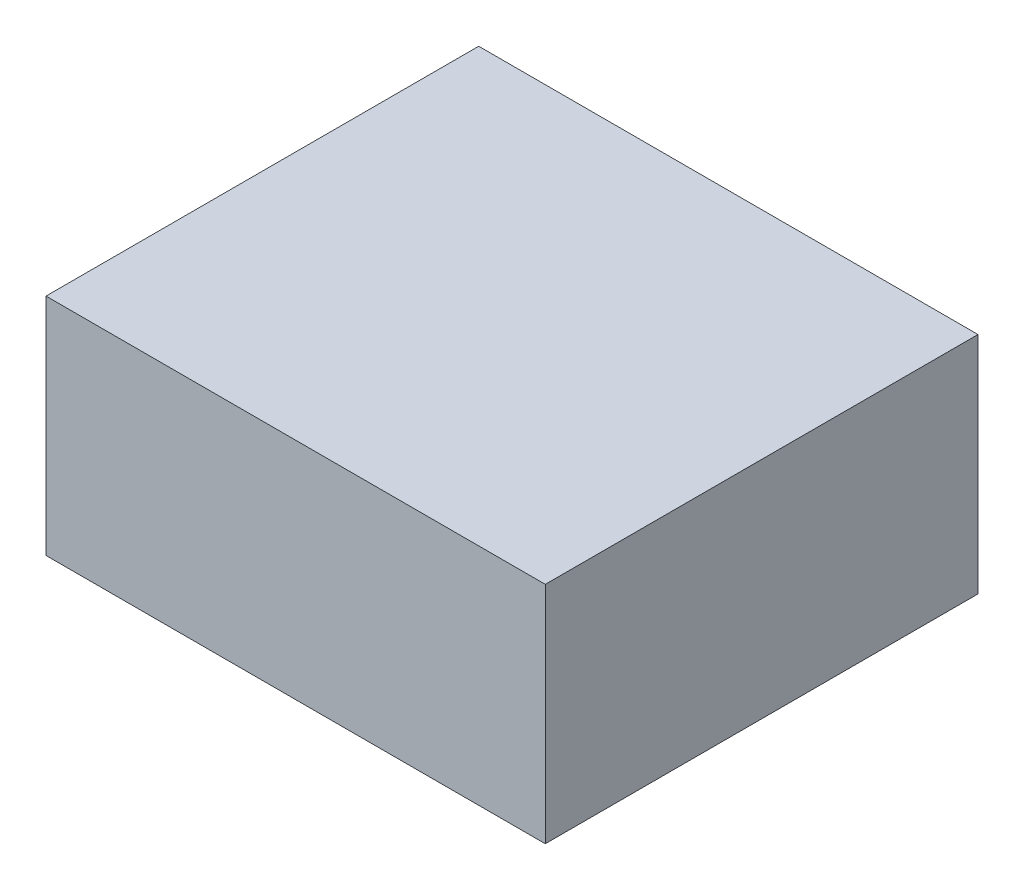
from build123d import *

# Parameters (mm, degrees)
SKETCH1_W           = 60
SKETCH1_H           = 52
BOSS_EXTRUDE1_DEPTH = 27


with BuildPart() as part:
    # Sketch1 → Boss-Extrude1 (new body)
    with BuildSketch(Plane(origin=(0, 0, 0), x_dir=(1, 0, 0), z_dir=(0, 1, 0))):
        Rectangle(SKETCH1_W, SKETCH1_H)
    extrude(amount=BOSS_EXTRUDE1_DEPTH)


solid = part.part
